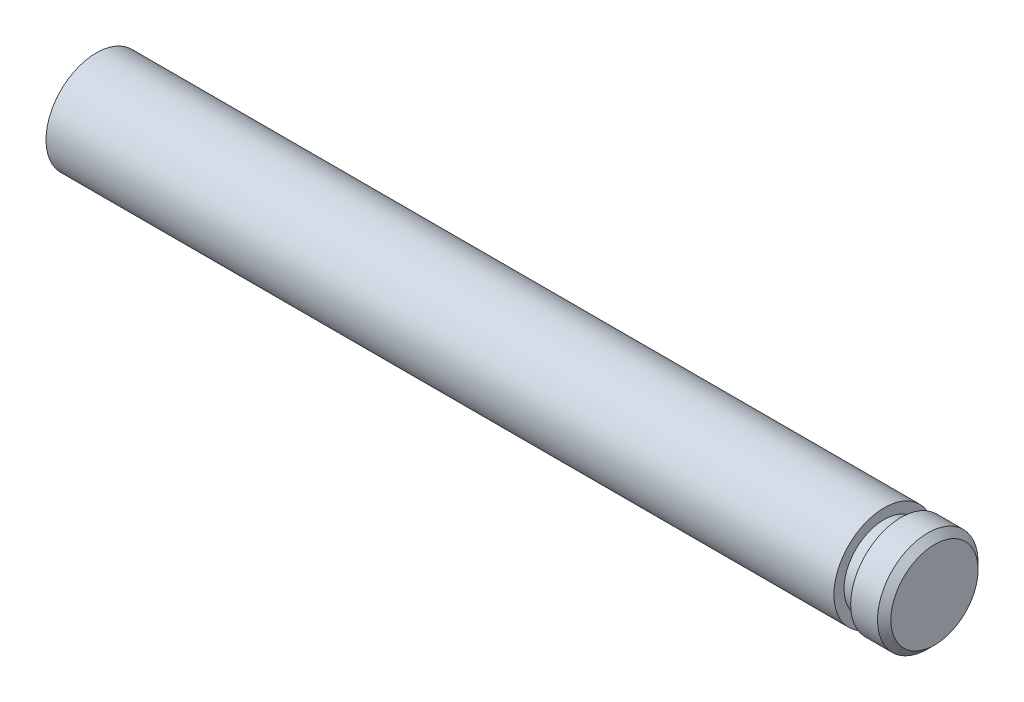
from build123d import *

# Parameters (mm, degrees)
CHAFL_N1_SIZE = 0.2


with BuildPart() as part:
    # Croquis1 → Revolución1 (revolve)
    with BuildSketch(Plane(origin=(0, 0, 0), x_dir=(1, 0, 0), z_dir=(0, 1, 0)), mode=Mode.PRIVATE) as revoluci_n1_sk:
        Polygon((0, 0), (25, 0), (25, 1.5), (24, 1.5), (24, 1.198324022), (23.5, 1.198324022), (23.5, 1.5), (0, 1.5), align=None)
    revolve(revoluci_n1_sk.sketch.rotate(Axis((0, 0, 0), (1, 0, 0)), 180), axis=Axis((0, 0, 0), (1, 0, 0)))

    # Chaflán1
    chafl_n1_edges = [part.edges().sort_by_distance(p)[0] for p in [
        (25, 0, -1.5),
    ]]
    chamfer(chafl_n1_edges, length=CHAFL_N1_SIZE)


solid = part.part
